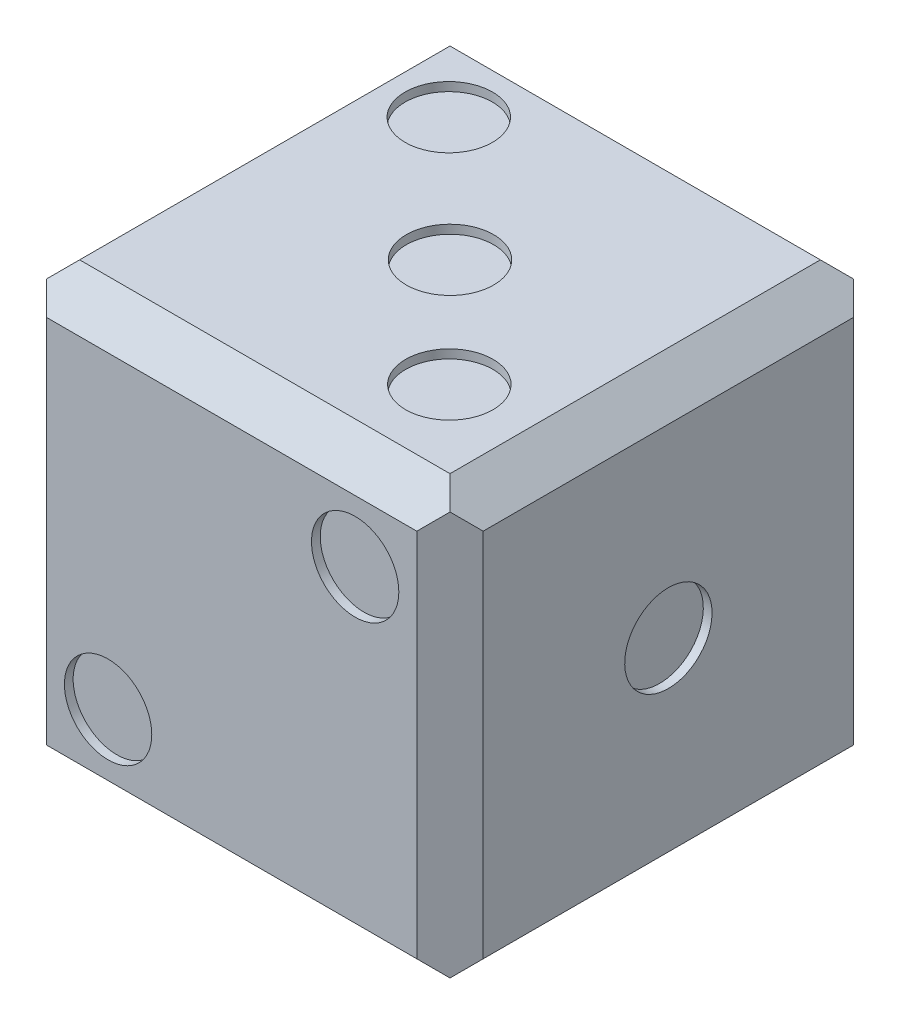
from build123d import *

# Parameters (mm, degrees)
SKETCH1_W           = 127
SKETCH1_H           = 127
CUBE_DEPTH          = 127
SKETCH1_2_W         = 127
SKETCH1_2_H         = 127
BOSS_EXTRUDE2_DEPTH = 127
SKETCH4_R           = 12.7
F_6_DOT_CUT_DEPTH   = 2.54
SKETCH9_R           = 12.7
F_4_DOT_CUT_DEPTH   = 2.54
SKETCH10_R          = 12.7
F_3_DOT_CUT_DEPTH   = 2.54
F_5_DOT_START       = -2.54
SKETCH11_R          = 12.7
F_5_DOT_CUT_DEPTH   = 2.54
SKETCH12_R          = 12.7
F_1_DOT_CUT_DEPTH   = 2.54
SKETCH13_R          = 12.7
F_2_DOT_CUT_DEPTH   = 2.54
CUT_EXTRUDE7_REACH  = 221.97
CUT_EXTRUDE8_REACH  = 221.97
CUT_EXTRUDE9_REACH  = 221.97


with BuildPart() as part:
    # Sketch1 → Cube (new body)
    with BuildSketch(Plane.XY):
        with Locations((63.5, 63.5)):
            Rectangle(SKETCH1_W, SKETCH1_H)
    extrude(amount=CUBE_DEPTH)

    # Sketch1<2> → Boss-Extrude2 (add)
    with BuildSketch(Plane.XY):
        with Locations((63.5, 63.5)):
            Rectangle(SKETCH1_2_W, SKETCH1_2_H)
    extrude(amount=BOSS_EXTRUDE2_DEPTH)

    # Sketch4 → 6-dot cut (cut)
    with BuildSketch(Plane(origin=(0, 0, 0), x_dir=(-1, 0, 0), z_dir=(0, 0, -1))):
        with Locations((-31.75, 63.5)):
            Circle(SKETCH4_R)
        with Locations((-31.75, 31.75)):
            Circle(SKETCH4_R)
        with Locations((-31.75, 95.25)):
            Circle(SKETCH4_R)
        with Locations((-95.25, 31.75)):
            Circle(SKETCH4_R)
        with Locations((-95.25, 63.5)):
            Circle(SKETCH4_R)
        with Locations((-95.25, 95.25)):
            Circle(SKETCH4_R)
    extrude(amount=-F_6_DOT_CUT_DEPTH, mode=Mode.SUBTRACT)

    # Sketch9 → 4-dot cut (cut)
    with BuildSketch(Plane.ZY):
        with Locations((95.25, 101.6)):
            Circle(SKETCH9_R)
        with Locations((95.25, 38.1)):
            Circle(SKETCH9_R)
        with Locations((31.75, 38.1)):
            Circle(SKETCH9_R)
        with Locations((31.75, 101.6)):
            Circle(SKETCH9_R)
    extrude(amount=-F_4_DOT_CUT_DEPTH, mode=Mode.SUBTRACT)

    # Sketch10 → 3-dot cut (cut)
    with BuildSketch(Plane(origin=(0, 127, 0), x_dir=(1, 0, 0), z_dir=(0, 1, 0))):
        with Locations((63.5, -63.5)):
            Circle(SKETCH10_R)
        with Locations((27.403839575, -27.75496954)):
            Circle(SKETCH10_R)
        with Locations((94.798796898, -94.988870563)):
            Circle(SKETCH10_R)
    extrude(amount=-F_3_DOT_CUT_DEPTH, mode=Mode.SUBTRACT)

    # Sketch11 → 5-dot cut (cut)
    with BuildSketch(Plane.XZ.offset(F_5_DOT_START)):
        with Locations((63.5, 63.5)):
            Circle(SKETCH11_R)
        with Locations((27.578975516, 27.578975516)):
            Circle(SKETCH11_R)
        with Locations((99.421024484, 99.421024484)):
            Circle(SKETCH11_R)
        with Locations((27.578975516, 99.421024484)):
            Circle(SKETCH11_R)
        with Locations((99.421024484, 27.578975516)):
            Circle(SKETCH11_R)
    extrude(amount=F_5_DOT_CUT_DEPTH, mode=Mode.SUBTRACT)

    # Sketch12 → 1-dot cut (cut)
    with BuildSketch(Plane(origin=(127, 0, 0), x_dir=(0, 0, -1), z_dir=(1, 0, 0))):
        with Locations((-63.5, 63.5)):
            Circle(SKETCH12_R)
    extrude(amount=-F_1_DOT_CUT_DEPTH, mode=Mode.SUBTRACT)

    # Sketch13 → 2-dot cut (cut)
    with BuildSketch(Plane.XY.offset(127)):
        with Locations((27.578975516, 27.578975516)):
            Circle(SKETCH13_R)
        with Locations((99.421024484, 99.421024484)):
            Circle(SKETCH13_R)
    extrude(amount=-F_2_DOT_CUT_DEPTH, mode=Mode.SUBTRACT)

    # Sketch16 → Cut-Extrude7 (cut, up to next)
    with BuildSketch(Plane.ZY, mode=Mode.PRIVATE) as cut_extrude7_sk1:
        Polygon((0, 127), (9.652, 127), (0, 117.348), align=None)
    cut_extrude7_tool1 = extrude(cut_extrude7_sk1.sketch, amount=-CUT_EXTRUDE7_REACH, mode=Mode.PRIVATE) & part.part
    # Sketch16 → Cut-Extrude7 (cut, up to next)
    with BuildSketch(Plane.ZY, mode=Mode.PRIVATE) as cut_extrude7_sk2:
        Polygon((117.348, 127), (127, 117.348), (127, 127), align=None)
    cut_extrude7_tool2 = extrude(cut_extrude7_sk2.sketch, amount=-CUT_EXTRUDE7_REACH, mode=Mode.PRIVATE) & part.part
    # Sketch16 → Cut-Extrude7 (cut, up to next)
    with BuildSketch(Plane.ZY, mode=Mode.PRIVATE) as cut_extrude7_sk3:
        Polygon((127, 0), (117.348, 0), (127, 9.652), align=None)
    cut_extrude7_tool3 = extrude(cut_extrude7_sk3.sketch, amount=-CUT_EXTRUDE7_REACH, mode=Mode.PRIVATE) & part.part
    # Sketch16 → Cut-Extrude7 (cut, up to next)
    with BuildSketch(Plane.ZY, mode=Mode.PRIVATE) as cut_extrude7_sk4:
        Polygon((9.652, 0), (0, 9.652), (0, 0), align=None)
    cut_extrude7_tool4 = extrude(cut_extrude7_sk4.sketch, amount=-CUT_EXTRUDE7_REACH, mode=Mode.PRIVATE) & part.part
    add(cut_extrude7_tool1.solids().sort_by_distance((0, 123.782667, 3.217333))[0], mode=Mode.SUBTRACT)
    add(cut_extrude7_tool2.solids().sort_by_distance((0, 123.782667, 123.782667))[0], mode=Mode.SUBTRACT)
    add(cut_extrude7_tool3.solids().sort_by_distance((0, 3.217333, 123.782667))[0], mode=Mode.SUBTRACT)
    add(cut_extrude7_tool4.solids().sort_by_distance((0, 3.217333, 3.217333))[0], mode=Mode.SUBTRACT)

    # Sketch17 → Cut-Extrude8 (cut, up to next)
    with BuildSketch(Plane.XY.offset(127), mode=Mode.PRIVATE) as cut_extrude8_sk1:
        Polygon((9.652, 127), (0, 127), (0, 117.348), align=None)
    cut_extrude8_tool1 = extrude(cut_extrude8_sk1.sketch, amount=-CUT_EXTRUDE8_REACH, mode=Mode.PRIVATE) & part.part
    # Sketch17 → Cut-Extrude8 (cut, up to next)
    with BuildSketch(Plane.XY.offset(127), mode=Mode.PRIVATE) as cut_extrude8_sk2:
        Polygon((117.348, 127), (127, 117.348), (127, 127), align=None)
    cut_extrude8_tool2 = extrude(cut_extrude8_sk2.sketch, amount=-CUT_EXTRUDE8_REACH, mode=Mode.PRIVATE) & part.part
    # Sketch17 → Cut-Extrude8 (cut, up to next)
    with BuildSketch(Plane.XY.offset(127), mode=Mode.PRIVATE) as cut_extrude8_sk3:
        Polygon((117.348, 0), (127, 0), (127, 9.652), align=None)
    cut_extrude8_tool3 = extrude(cut_extrude8_sk3.sketch, amount=-CUT_EXTRUDE8_REACH, mode=Mode.PRIVATE) & part.part
    # Sketch17 → Cut-Extrude8 (cut, up to next)
    with BuildSketch(Plane.XY.offset(127), mode=Mode.PRIVATE) as cut_extrude8_sk4:
        Polygon((9.652, 0), (0, 0), (0, 9.652), align=None)
    cut_extrude8_tool4 = extrude(cut_extrude8_sk4.sketch, amount=-CUT_EXTRUDE8_REACH, mode=Mode.PRIVATE) & part.part
    add(cut_extrude8_tool1.solids().sort_by_distance((3.217333, 123.782667, 127))[0], mode=Mode.SUBTRACT)
    add(cut_extrude8_tool2.solids().sort_by_distance((123.782667, 123.782667, 127))[0], mode=Mode.SUBTRACT)
    add(cut_extrude8_tool3.solids().sort_by_distance((123.782667, 3.217333, 127))[0], mode=Mode.SUBTRACT)
    add(cut_extrude8_tool4.solids().sort_by_distance((3.217333, 3.217333, 127))[0], mode=Mode.SUBTRACT)

    # Sketch18 → Cut-Extrude9 (cut, up to next)
    with BuildSketch(Plane(origin=(0, 127, 0), x_dir=(1, 0, 0), z_dir=(0, 1, 0)), mode=Mode.PRIVATE) as cut_extrude9_sk1:
        Polygon((0, 0), (9.652, 0), (0, -9.652), align=None)
    cut_extrude9_tool1 = extrude(cut_extrude9_sk1.sketch, amount=-CUT_EXTRUDE9_REACH, mode=Mode.PRIVATE) & part.part
    # Sketch18 → Cut-Extrude9 (cut, up to next)
    with BuildSketch(Plane(origin=(0, 127, 0), x_dir=(1, 0, 0), z_dir=(0, 1, 0)), mode=Mode.PRIVATE) as cut_extrude9_sk2:
        Polygon((117.348, 0), (127, -9.652), (127, 0), align=None)
    cut_extrude9_tool2 = extrude(cut_extrude9_sk2.sketch, amount=-CUT_EXTRUDE9_REACH, mode=Mode.PRIVATE) & part.part
    # Sketch18 → Cut-Extrude9 (cut, up to next)
    with BuildSketch(Plane(origin=(0, 127, 0), x_dir=(1, 0, 0), z_dir=(0, 1, 0)), mode=Mode.PRIVATE) as cut_extrude9_sk3:
        Polygon((127, -127), (117.348, -127), (127, -117.348), align=None)
    cut_extrude9_tool3 = extrude(cut_extrude9_sk3.sketch, amount=-CUT_EXTRUDE9_REACH, mode=Mode.PRIVATE) & part.part
    # Sketch18 → Cut-Extrude9 (cut, up to next)
    with BuildSketch(Plane(origin=(0, 127, 0), x_dir=(1, 0, 0), z_dir=(0, 1, 0)), mode=Mode.PRIVATE) as cut_extrude9_sk4:
        Polygon((9.652, -127), (0, -117.348), (0, -127), align=None)
    cut_extrude9_tool4 = extrude(cut_extrude9_sk4.sketch, amount=-CUT_EXTRUDE9_REACH, mode=Mode.PRIVATE) & part.part
    add(cut_extrude9_tool1.solids().sort_by_distance((3.217333, 127, 3.217333))[0], mode=Mode.SUBTRACT)
    add(cut_extrude9_tool2.solids().sort_by_distance((123.782667, 127, 3.217333))[0], mode=Mode.SUBTRACT)
    add(cut_extrude9_tool3.solids().sort_by_distance((123.782667, 127, 123.782667))[0], mode=Mode.SUBTRACT)
    add(cut_extrude9_tool4.solids().sort_by_distance((3.217333, 127, 123.782667))[0], mode=Mode.SUBTRACT)


solid = part.part
